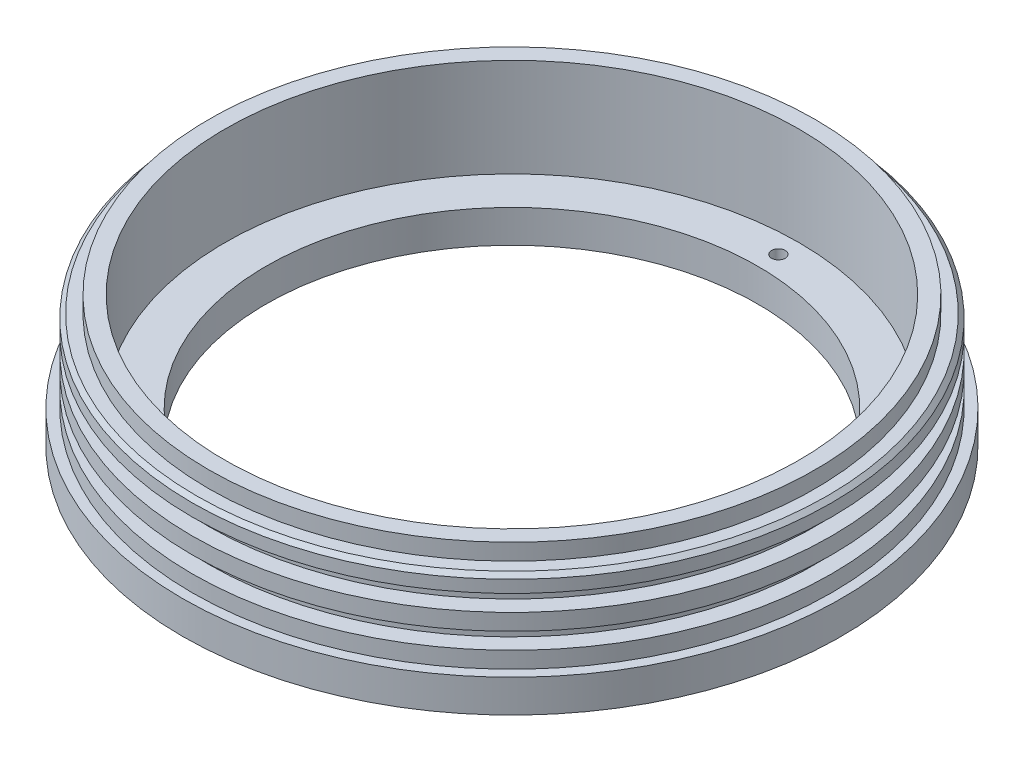
from build123d import *

# Parameters (mm, degrees)
SKETCH1_R           = 51.054
SKETCH1_R_2         = 38.1
BOSS_EXTRUDE1_DEPTH = 5.08
SKETCH2_R           = 49.53
SKETCH2_R_2         = 44.45
BOSS_EXTRUDE2_DEPTH = 15.24
SKETCH4_W           = 2.54
SKETCH4_H           = 2.54
CHAMFER1_SIZE       = 0.635
CUT_EXTRUDE1_DEPTH  = 26.67


with BuildPart() as part:
    # Sketch1 → Boss-Extrude1 (new body)
    with BuildSketch(Plane(origin=(0, 0, 0), x_dir=(1, 0, 0), z_dir=(0, 1, 0))):
        with Locations(Location((0, 0, 0), (0, 0, 270))):
            Circle(SKETCH1_R)
        with Locations(Location((0, 0, 0), (0, 0, 270))):
            Circle(SKETCH1_R_2, mode=Mode.SUBTRACT)
    extrude(amount=BOSS_EXTRUDE1_DEPTH)

    # Sketch2 → Boss-Extrude2 (add)
    with BuildSketch(Plane(origin=(0, 5.08, 0), x_dir=(1, 0, 0), z_dir=(0, 1, 0))):
        with Locations(Location((0, 0, 0), (0, 0, 90))):
            Circle(SKETCH2_R)
        with Locations(Location((0, 0, 0), (0, 0, 90))):
            Circle(SKETCH2_R_2, mode=Mode.SUBTRACT)
    extrude(amount=BOSS_EXTRUDE2_DEPTH)

    # Sketch4 → Cut-Revolve1 (revolve, cut)
    with BuildSketch(Plane.XY, mode=Mode.PRIVATE) as cut_revolve1_sk:
        with Locations((-48.26, 8.89)):
            Rectangle(SKETCH4_W, SKETCH4_H)
        with Locations((-48.26, 13.97)):
            Rectangle(SKETCH4_W, SKETCH4_H)
        with Locations((-48.26, 19.05)):
            Rectangle(SKETCH4_W, SKETCH4_H)
    revolve(cut_revolve1_sk.sketch.rotate(Axis((0, 0, 0), (0, 1, 0)), 270), axis=Axis((0, 0, 0), (0, 1, 0)), mode=Mode.SUBTRACT)

    # Chamfer1
    chamfer1_edges = [part.edges().sort_by_distance(p)[0] for p in [
        (0, 17.78, 49.53),
    ]]
    chamfer(chamfer1_edges, length=CHAMFER1_SIZE)

    # Sketch5 → Cut-Extrude1 (cut)
    with BuildSketch(Plane(origin=(0, 5.08, 0), x_dir=(1, 0, 0), z_dir=(0, 1, 0))):
        with BuildLine():
            ThreePointArc((0, 42.333333164), (-1.058333164, 41.275), (0, 40.216666836))
            Line((0, 40.216666836), (0, 42.333333164))
        make_face()
        with BuildLine():
            Line((0, 42.333333164), (0, 40.216666836))
            ThreePointArc((0, 40.216666836), (0.748354557, 40.526645443), (1.058333164, 41.275))
            ThreePointArc((1.058333164, 41.275), (0.748354557, 42.023354557), (0, 42.333333164))
        make_face()
    extrude(amount=-CUT_EXTRUDE1_DEPTH, mode=Mode.SUBTRACT)


solid = part.part
